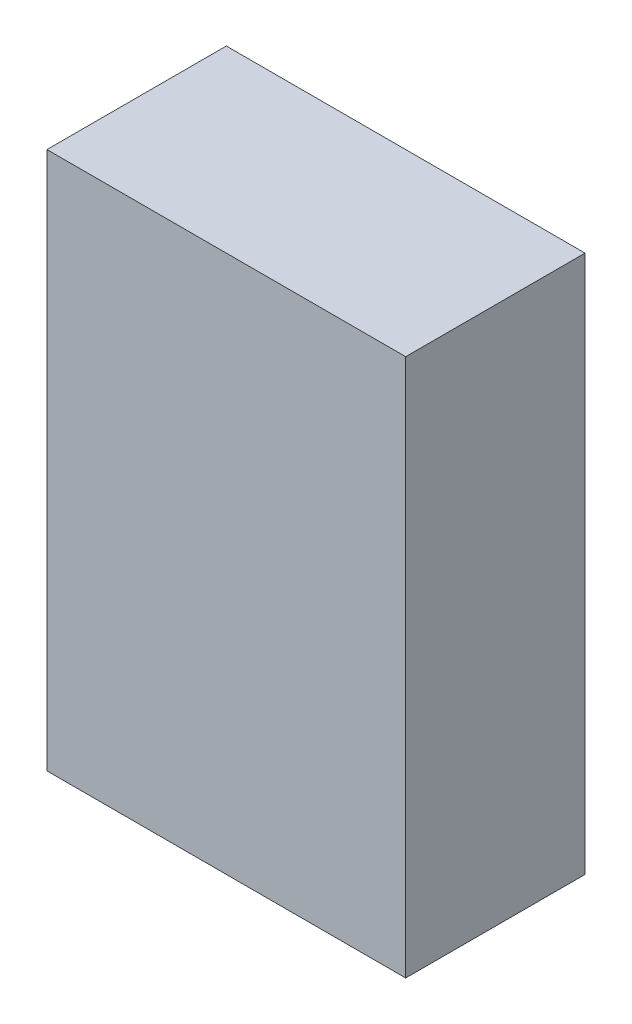
from build123d import *

# Parameters (mm, degrees)
SKETCH1_W          = 50.8
SKETCH1_H          = 25.4
DEMO_EXTRUDE_DEPTH = 76.2


with BuildPart() as part:
    # Sketch1 → Demo-Extrude (new body)
    with BuildSketch(Plane(origin=(0, 0, 0), x_dir=(1, 0, 0), z_dir=(0, 1, 0))):
        Rectangle(SKETCH1_W, SKETCH1_H)
    extrude(amount=DEMO_EXTRUDE_DEPTH)


solid = part.part
